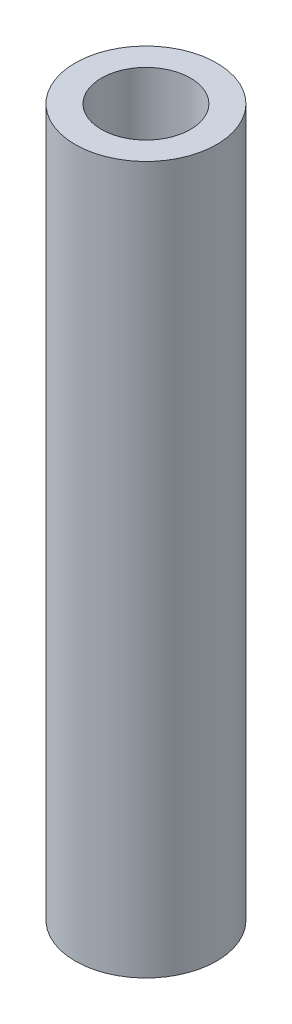
from build123d import *

# Parameters (mm, degrees)
SKETCH2_R           = 3.175
SKETCH2_R_2         = 2
BOSS_EXTRUDE1_DEPTH = 31.75


with BuildPart() as part:
    # Sketch2 → Boss-Extrude1 (new body)
    with BuildSketch(Plane(origin=(0, 0, 0), x_dir=(1, 0, 0), z_dir=(0, 1, 0))):
        with Locations(Location((0, 0, 0), (0, 0, 270))):
            Circle(SKETCH2_R)
        with Locations(Location((0, 0, 0), (0, 0, 270))):
            Circle(SKETCH2_R_2, mode=Mode.SUBTRACT)
    extrude(amount=BOSS_EXTRUDE1_DEPTH)


solid = part.part
